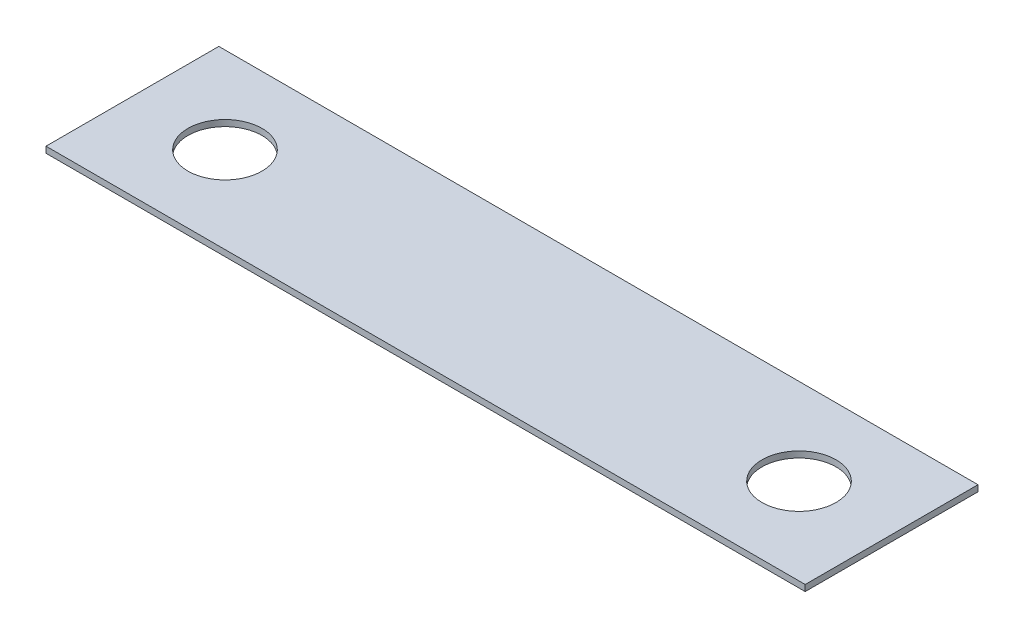
from build123d import *

# Parameters (mm, degrees)
SKIZZE1_W                       = 123
SKIZZE1_H                       = 28
AUFSATZ_LINEAR_AUSTRAGEN1_DEPTH = 1
SKIZZE2_R                       = 6
SCHNITT_LINEAR_AUSTRAGEN1_DEPTH = 64.081296753


with BuildPart() as part:
    # Skizze1 → Aufsatz-Linear austragen1 (new body)
    with BuildSketch(Plane(origin=(0, 0, 0), x_dir=(1, 0, 0), z_dir=(0, 1, 0))):
        Rectangle(SKIZZE1_W, SKIZZE1_H)
    extrude(amount=AUFSATZ_LINEAR_AUSTRAGEN1_DEPTH)

    # Skizze2 → Schnitt-Linear austragen1 (cut, through all)
    with BuildSketch(Plane(origin=(0, 1, 0), x_dir=(1, 0, 0), z_dir=(0, 1, 0))):
        with Locations(Location((46.5, 0, 0), (0, 0, 270))):
            Circle(SKIZZE2_R)
        with Locations(Location((-46.5, 0, 0), (0, 0, 270))):
            Circle(SKIZZE2_R)
    extrude(amount=-SCHNITT_LINEAR_AUSTRAGEN1_DEPTH, mode=Mode.SUBTRACT)


solid = part.part
